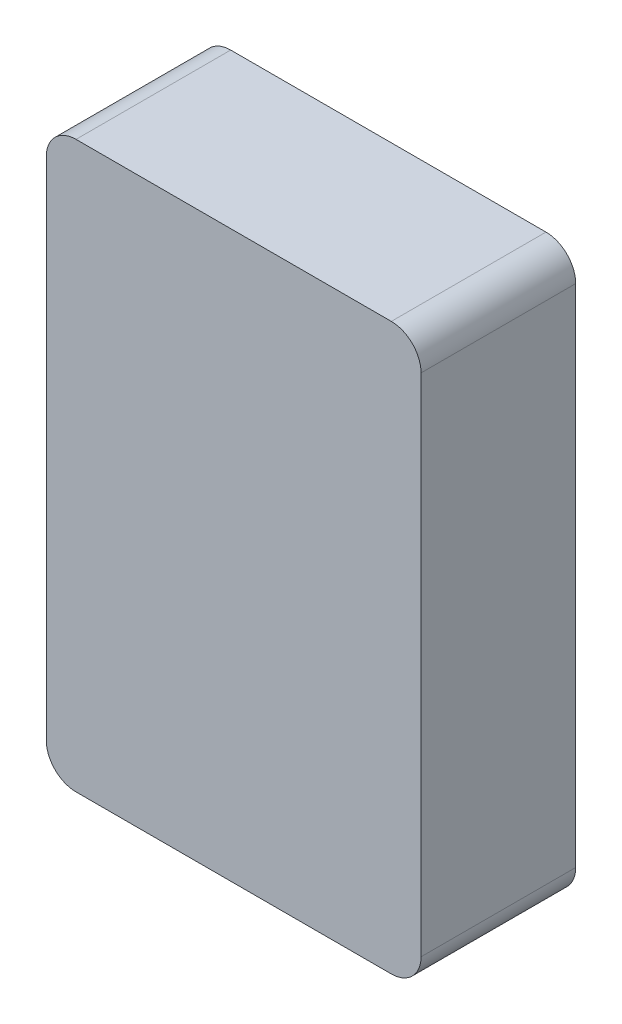
from build123d import *

# Parameters (mm, degrees)
ESBO_O3_W                = 63
ESBO_O3_H                = 95
RESSALTO_EXTRUS_O1_DEPTH = 26
FILETE1_R                = 5


with BuildPart() as part:
    # Esboço3 → Ressalto-extrusão1 (new body)
    with BuildSketch(Plane.XY):
        with Locations((0, 73.917756745)):
            Rectangle(ESBO_O3_W, ESBO_O3_H)
    extrude(amount=RESSALTO_EXTRUS_O1_DEPTH)

    # Filete1
    filete1_edges = [part.edges().sort_by_distance(p)[0] for p in [
        (31.5, 26.417756745, 13),
        (-31.5, 26.417756745, 13),
        (-31.5, 121.417756745, 13),
        (31.5, 121.417756745, 13),
    ]]
    fillet(filete1_edges, radius=FILETE1_R)


solid = part.part
